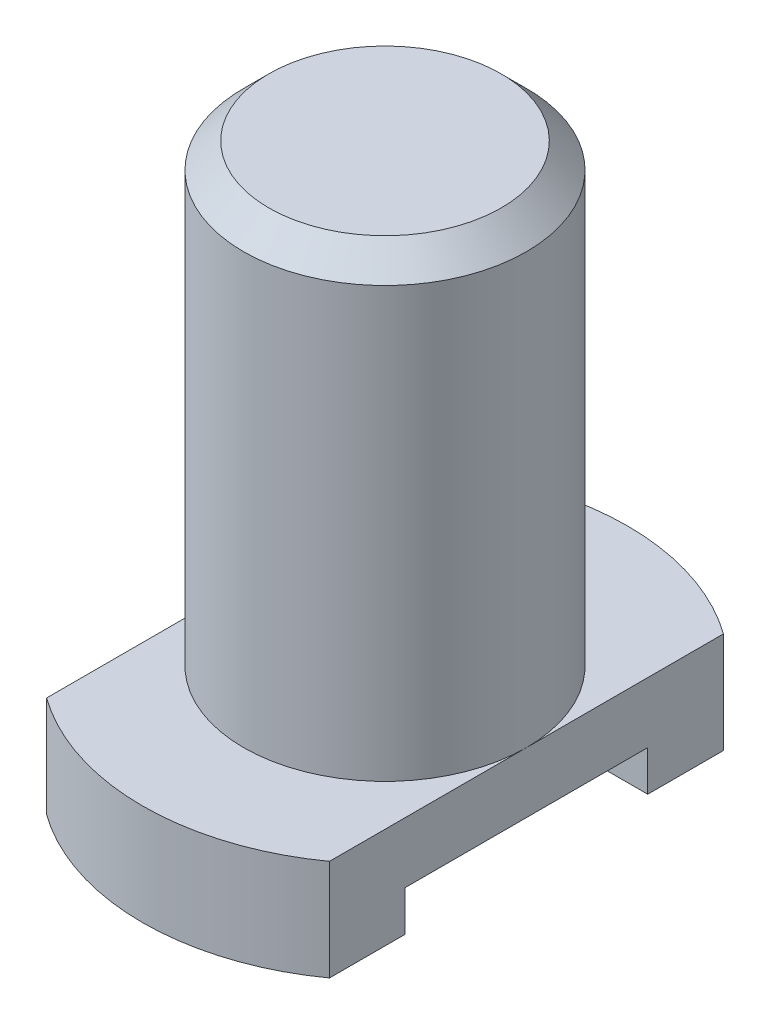
from build123d import *

# Parameters (mm, degrees)
SKETCH1_R           = 1.4
BOSS_EXTRUDE3_DEPTH = 5.5
BOSS_EXTRUDE4_DEPTH = 1
CHAMFER1_SIZE       = 0.25
SKETCH4_W           = 2.4
SKETCH4_H           = 0.8
CUT_EXTRUDE1_DEPTH  = 3.6


with BuildPart() as part:
    # Sketch1 → Boss-Extrude3 (new body)
    with BuildSketch(Plane(origin=(0, 0, 0), x_dir=(1, 0, 0), z_dir=(0, 1, 0))):
        with Locations(Location((0, 0, 0), (0, 0, 270))):
            Circle(SKETCH1_R)
    extrude(amount=BOSS_EXTRUDE3_DEPTH)

    # Sketch3 → Boss-Extrude4 (add)
    with BuildSketch(Plane(origin=(0, 0, 0), x_dir=(1, 0, 0), z_dir=(0, 1, 0))):
        with BuildLine():
            Line((-1.4, 0), (-1.4, -1.949358869))
            ThreePointArc((-1.4, -1.949358869), (0, -2.4), (1.4, -1.949358869))
            Line((1.4, -1.949358869), (1.4, 0))
            ThreePointArc((1.4, 0), (0, -1.4), (-1.4, 0))
        make_face()
        with BuildLine():
            Line((-1.4, 1.949358869), (-1.4, 0))
            ThreePointArc((-1.4, 0), (0, 1.4), (1.4, 0))
            Line((1.4, 0), (1.4, 1.949358869))
            ThreePointArc((1.4, 1.949358869), (0, 2.4), (-1.4, 1.949358869))
        make_face()
    extrude(amount=BOSS_EXTRUDE4_DEPTH)

    # Chamfer1
    chamfer1_edges = [part.edges().sort_by_distance(p)[0] for p in [
        (0, 5.5, -1.4),
    ]]
    chamfer(chamfer1_edges, length=CHAMFER1_SIZE)

    # Sketch4 → Cut-Extrude1 (cut)
    with BuildSketch(Plane(origin=(1.4, 0, 0), x_dir=(0, 0, -1), z_dir=(1, 0, 0))):
        Rectangle(SKETCH4_W, SKETCH4_H)
    extrude(amount=-CUT_EXTRUDE1_DEPTH, mode=Mode.SUBTRACT)


solid = part.part
